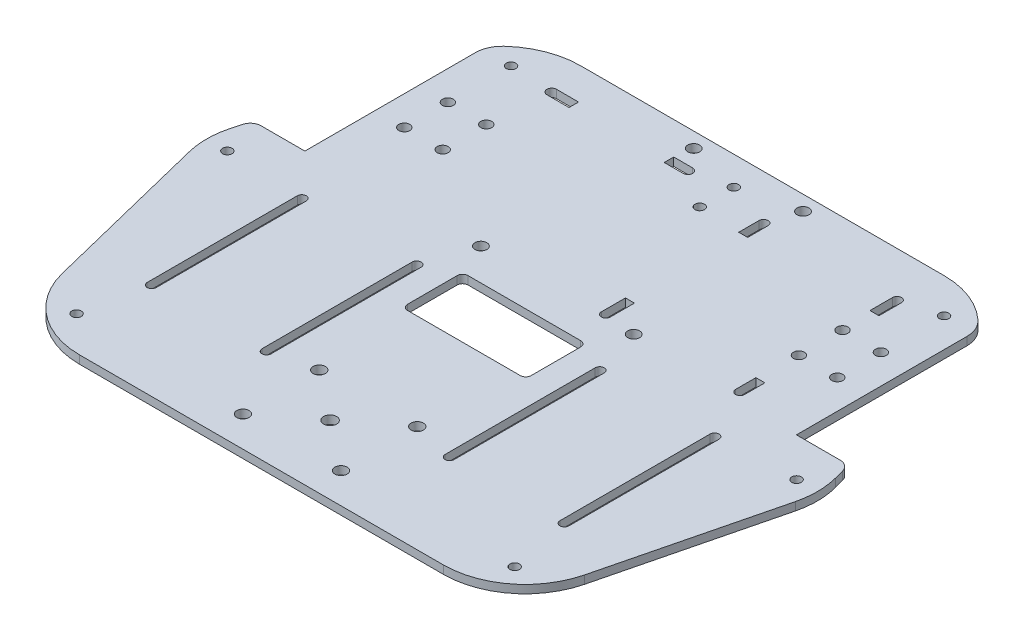
from build123d import *

# Parameters (mm, degrees)
SKETCH_1_R           = 2.414816814
EXTRUDE_1_DEPTH      = 3
SKETCH_2_R           = 1.75
CUT_EXTRUDE_1_DEPTH  = 10
SKETCH_3_R           = 1.75
CUT_EXTRUDE_2_DEPTH  = 10
SKETCH_4_R           = 2
CUT_EXTRUDE_3_DEPTH  = 10
SKETCH_5_R           = 2.187098749
CUT_EXTRUDE_4_DEPTH  = 10
SKETCH_6_R           = 1.75
CUT_EXTRUDE_5_DEPTH  = 10
CUT_EXTRUDE_6_DEPTH  = 10
CUT_EXTRUDE_7_DEPTH  = 10
CUT_EXTRUDE_8_DEPTH  = 10
CUT_EXTRUDE_9_DEPTH  = 10
SKETCH_12_R          = 2.25
CUT_EXTRUDE_10_DEPTH = 10


with BuildPart() as part:
    # 草图1 → 凸台-拉伸1 (new body)
    with BuildSketch(Plane(origin=(0, 0, 0), x_dir=(1, 0, 0), z_dir=(0, 1, 0))):
        with BuildLine():
            Line((90.25, 83.348649636), (90.25, 115.848649636))
            Line((90.25, 115.848649636), (90.25, 131.848649636))
            Line((90.25, 131.848649636), (90.25, 139.378275452))
            ThreePointArc((90.25, 139.378275452), (89.397323186, 143.418879184), (86.984704295, 146.770417094))
            ThreePointArc((86.984704295, 146.770417094), (77.613579276, 152.56980983), (66.78059141, 154.593992167))
            Line((66.78059141, 154.593992167), (-66.78059141, 154.593992167))
            ThreePointArc((-66.78059141, 154.593992167), (-77.613579276, 152.56980983), (-86.984704295, 146.770417094))
            ThreePointArc((-86.984704295, 146.770417094), (-89.397323186, 143.418879184), (-90.25, 139.378275452))
            Line((-90.25, 139.378275452), (-90.25, 131.848649636))
            Line((-90.25, 131.848649636), (-90.25, 83.348649636))
            Line((-90.25, 83.348649636), (-90.25, 76.831438081))
            Line((-90.25, 76.831438081), (-106.330217655, 76.831438081))
            ThreePointArc((-106.330217655, 76.831438081), (-108.765530777, 76.004646236), (-110.194095385, 73.86606308))
            Line((-110.194095385, 73.86606308), (-111.126521712, 70.383853271))
            ThreePointArc((-111.126521712, 70.383853271), (-112.146146857, 62.902573916), (-111.265547961, 55.403659207))
            Line((-111.265547961, 55.403659207), (-95.898700635, -6.566167178))
            ThreePointArc((-95.898700635, -6.566167178), (-85.265515034, -22.974194171), (-66.78059141, -29.345660602))
            Line((-66.78059141, -29.345660602), (66.78059141, -29.345660602))
            ThreePointArc((66.78059141, -29.345660602), (85.265515034, -22.974194171), (95.898700635, -6.566167178))
            Line((95.898700635, -6.566167178), (111.265547961, 55.403659207))
            ThreePointArc((111.265547961, 55.403659207), (112.146146857, 62.902573916), (111.126521712, 70.383853271))
            Line((111.126521712, 70.383853271), (110.194095385, 73.86606308))
            ThreePointArc((110.194095385, 73.86606308), (108.765530777, 76.004646236), (106.330217655, 76.831438081))
            Line((106.330217655, 76.831438081), (90.25, 76.831438081))
            Line((90.25, 76.831438081), (90.25, 83.348649636))
        make_face()
        with Locations(Location((0, -4.151350364, 0), (0, 0, 270))):
            Circle(SKETCH_1_R, mode=Mode.SUBTRACT)
    extrude(amount=EXTRUDE_1_DEPTH)

    # 草图2 → 切除-拉伸1 (cut)
    with BuildSketch(Plane(origin=(0, 3, 0), x_dir=(1, 0, 0), z_dir=(0, 1, 0))):
        with Locations(Location((80.450184708, -16.818951307, 0), (0, 0, 270))):
            Circle(SKETCH_2_R)
        with Locations(Location((104.507530951, 62.624165782, 0), (0, 0, 270))):
            Circle(SKETCH_2_R)
        with Locations(Location((-104.507530951, 62.624165782, 0), (0, 0, 270))):
            Circle(SKETCH_2_R)
        with Locations(Location((-80.450184708, -16.818951307, 0), (0, 0, 270))):
            Circle(SKETCH_2_R)
    extrude(amount=-CUT_EXTRUDE_1_DEPTH, mode=Mode.SUBTRACT)

    # 草图3 → 切除-拉伸2 (cut)
    with BuildSketch(Plane(origin=(0, 3, 0), x_dir=(1, 0, 0), z_dir=(0, 1, 0))):
        with Locations(Location((0, 131.568155221, 0), (0, 0, 270))):
            Circle(SKETCH_3_R)
        with Locations(Location((0, 144.079729864, 0), (0, 0, 270))):
            Circle(SKETCH_3_R)
    extrude(amount=-CUT_EXTRUDE_2_DEPTH, mode=Mode.SUBTRACT)

    # 草图4 → 切除-拉伸3 (cut)
    with BuildSketch(Plane.XZ):
        with Locations(Location((79.5, -102.598649636, 0), (0, 0, 270))):
            Circle(SKETCH_4_R)
        with Locations(Location((65.4, -102.598649636, 0), (0, 0, 270))):
            Circle(SKETCH_4_R)
        with Locations(Location((65.4, -118.598649636, 0), (0, 0, 270))):
            Circle(SKETCH_4_R)
        with Locations(Location((79.5, -118.598649636, 0), (0, 0, 270))):
            Circle(SKETCH_4_R)
        with Locations(Location((-65.4, -102.598649636, 0), (0, 0, 270))):
            Circle(SKETCH_4_R)
        with Locations(Location((-79.5, -102.598649636, 0), (0, 0, 270))):
            Circle(SKETCH_4_R)
        with Locations(Location((-79.5, -118.598649636, 0), (0, 0, 270))):
            Circle(SKETCH_4_R)
        with Locations(Location((-65.4, -118.598649636, 0), (0, 0, 270))):
            Circle(SKETCH_4_R)
    extrude(amount=-CUT_EXTRUDE_3_DEPTH, mode=Mode.SUBTRACT)

    # 草图5 → 切除-拉伸4 (cut)
    with BuildSketch(Plane(origin=(0, 3, 0), x_dir=(1, 0, 0), z_dir=(0, 1, 0))):
        with Locations(Location((28.387774848, 78.93312243, 0), (0, 0, 270))):
            Circle(SKETCH_5_R)
        with Locations(Location((-27.718646552, 78.93312243, 0), (0, 0, 270))):
            Circle(SKETCH_5_R)
        with Locations(Location((20.384564295, 149.11485609, 0), (0, 0, 270))):
            Circle(SKETCH_5_R)
        with Locations(Location((-19.695499635, 149.054892436, 0), (0, 0, 270))):
            Circle(SKETCH_5_R)
    extrude(amount=-CUT_EXTRUDE_4_DEPTH, mode=Mode.SUBTRACT)

    # 草图6 → 切除-拉伸5 (cut)
    with BuildSketch(Plane(origin=(0, 3, 0), x_dir=(1, 0, 0), z_dir=(0, 1, 0))):
        with Locations(Location((79.5, 141.78226533, 0), (0, 0, 270))):
            Circle(SKETCH_6_R)
        with Locations(Location((-79.5, 141.78226533, 0), (0, 0, 270))):
            Circle(SKETCH_6_R)
    extrude(amount=-CUT_EXTRUDE_5_DEPTH, mode=Mode.SUBTRACT)

    # 草图7 → 切除-拉伸6 (cut)
    with BuildSketch(Plane(origin=(0, 3, 0), x_dir=(1, 0, 0), z_dir=(0, 1, 0))):
        with BuildLine():
            Line((67.913857225, 80.150069555), (67.913857225, 87.58815074))
            Line((67.913857225, 87.58815074), (64.613857225, 87.58815074))
            Line((64.613857225, 87.58815074), (64.613857225, 80.150069555))
            ThreePointArc((64.613857225, 80.150069555), (66.263857225, 78.500069555), (67.913857225, 80.150069555))
        make_face()
        with BuildLine():
            Line((18.51822815, 138.15000011), (18.51822815, 130.666323995))
            Line((18.51822815, 130.666323995), (15.21822815, 130.666323995))
            Line((15.21822815, 130.666323995), (15.21822815, 138.15000011))
            ThreePointArc((15.21822815, 138.15000011), (16.86822815, 139.80000011), (18.51822815, 138.15000011))
        make_face()
        with BuildLine():
            Line((18.607981267, 80.150069555), (18.607981267, 88.993926487))
            Line((18.607981267, 88.993926487), (15.307981267, 88.993926487))
            Line((15.307981267, 88.993926487), (15.307981267, 80.150069555))
            ThreePointArc((15.307981267, 80.150069555), (16.957981267, 78.500069555), (18.607981267, 80.150069555))
        make_face()
        with BuildLine():
            Line((64.21822815, 138.15000011), (64.21822815, 129.866807359))
            Line((64.21822815, 129.866807359), (67.51822815, 129.866807359))
            Line((67.51822815, 129.866807359), (67.51822815, 138.15000011))
            ThreePointArc((67.51822815, 138.15000011), (65.86822815, 139.80000011), (64.21822815, 138.15000011))
        make_face()
    extrude(amount=-CUT_EXTRUDE_6_DEPTH, mode=Mode.SUBTRACT)

    # 草图8 → 切除-拉伸7 (cut)
    with BuildSketch(Plane(origin=(0, 3, 0), x_dir=(1, 0, 0), z_dir=(0, 1, 0))):
        with BuildLine():
            Line((-63.718637525, 139.174595172), (-55.596846554, 139.174595172))
            Line((-55.596846554, 139.174595172), (-55.596846554, 142.674595172))
            Line((-55.596846554, 142.674595172), (-63.718637525, 142.674595172))
            ThreePointArc((-63.718637525, 142.674595172), (-65.468637525, 140.924595172), (-63.718637525, 139.174595172))
        make_face()
        with BuildLine():
            Line((-13.718637525, 142.674595172), (-20.649379666, 142.674595172))
            Line((-20.649379666, 142.674595172), (-20.649379666, 139.174595172))
            Line((-20.649379666, 139.174595172), (-13.718637525, 139.174595172))
            ThreePointArc((-13.718637525, 139.174595172), (-11.968637525, 140.924595172), (-13.718637525, 142.674595172))
        make_face()
    extrude(amount=-CUT_EXTRUDE_7_DEPTH, mode=Mode.SUBTRACT)

    # 草图9 → 切除-拉伸8 (cut)
    with BuildSketch(Plane(origin=(0, 3, 0), x_dir=(1, 0, 0), z_dir=(0, 1, 0))):
        with BuildLine():
            Line((-20.688628359, 67.186553007), (20.688628359, 67.186553007))
            ThreePointArc((20.688628359, 67.186553007), (22.102841921, 66.600766569), (22.688628359, 65.186553007))
            Line((22.688628359, 65.186553007), (22.688628359, 46.991155699))
            ThreePointArc((22.688628359, 46.991155699), (22.102841921, 45.576942137), (20.688628359, 44.991155699))
            Line((20.688628359, 44.991155699), (-20.688628359, 44.991155699))
            ThreePointArc((-20.688628359, 44.991155699), (-22.102841921, 45.576942137), (-22.688628359, 46.991155699))
            Line((-22.688628359, 46.991155699), (-22.688628359, 65.186553007))
            ThreePointArc((-22.688628359, 65.186553007), (-22.102841921, 66.600766569), (-20.688628359, 67.186553007))
        make_face()
    extrude(amount=-CUT_EXTRUDE_8_DEPTH, mode=Mode.SUBTRACT)

    # 草图11 → 切除-拉伸9 (cut)
    with BuildSketch(Plane(origin=(0, 3, 0), x_dir=(1, 0, 0), z_dir=(0, 1, 0))):
        with BuildLine():
            Line((-74.128270021, 61.234629534), (-74.128270021, 6.121895865))
            ThreePointArc((-74.128270021, 6.121895865), (-75.778270021, 4.471895865), (-77.428270021, 6.121895865))
            Line((-77.428270021, 6.121895865), (-77.428270021, 61.234629534))
            ThreePointArc((-77.428270021, 61.234629534), (-75.778270021, 62.884629534), (-74.128270021, 61.234629534))
        make_face()
        with BuildLine():
            Line((-31.968935269, 61.234629534), (-31.968935269, 6.121895865))
            ThreePointArc((-31.968935269, 6.121895865), (-33.618935269, 4.471895865), (-35.268935269, 6.121895865))
            Line((-35.268935269, 6.121895865), (-35.268935269, 61.234629534))
            ThreePointArc((-35.268935269, 61.234629534), (-33.618935269, 62.884629534), (-31.968935269, 61.234629534))
        make_face()
        with BuildLine():
            Line((31.968935269, 61.234629534), (31.968935269, 6.121895865))
            ThreePointArc((31.968935269, 6.121895865), (33.618935269, 4.471895865), (35.268935269, 6.121895865))
            Line((35.268935269, 6.121895865), (35.268935269, 61.234629534))
            ThreePointArc((35.268935269, 61.234629534), (33.618935269, 62.884629534), (31.968935269, 61.234629534))
        make_face()
        with BuildLine():
            Line((74.128270021, 61.234629534), (74.128270021, 6.121895865))
            ThreePointArc((74.128270021, 6.121895865), (75.778270021, 4.471895865), (77.428270021, 6.121895865))
            Line((77.428270021, 6.121895865), (77.428270021, 61.234629534))
            ThreePointArc((77.428270021, 61.234629534), (75.778270021, 62.884629534), (74.128270021, 61.234629534))
        make_face()
    extrude(amount=-CUT_EXTRUDE_9_DEPTH, mode=Mode.SUBTRACT)

    # 草图12 → 切除-拉伸10 (cut)
    with BuildSketch(Plane.XZ):
        with Locations(Location((18, 18.151350364, 0), (0, 0, 270))):
            Circle(SKETCH_12_R)
        with Locations(Location((18, -9.848649636, 0), (0, 0, 90))):
            Circle(SKETCH_12_R)
        with Locations(Location((-18, 18.151350364, 0), (0, 0, 90))):
            Circle(SKETCH_12_R)
        with Locations(Location((-18, -9.848649636, 0), (0, 0, 270))):
            Circle(SKETCH_12_R)
    extrude(amount=-CUT_EXTRUDE_10_DEPTH, mode=Mode.SUBTRACT)


solid = part.part
